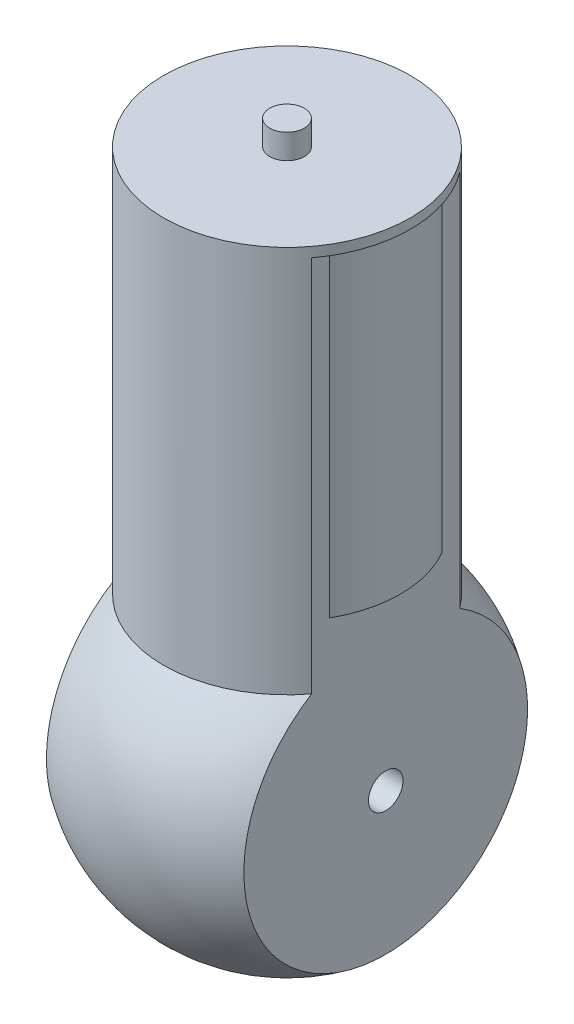
from build123d import *
from build123d.topology import SkipClean

# Parameters (mm, degrees)
CUT_EXTRUDE1_DEPTH      = 35
CUT_EXTRUDE1_DEPTH_BACK = 35
SKETCH2_OUTSIDE_W       = 96.248
SKETCH2_OUTSIDE_H       = 96.248
BOSS_EXTRUDE1_DEPTH     = 36
SKETCH4_R               = 3.5
CUT_EXTRUDE2_DEPTH      = 5
LPATTERN1_COUNT         = 2
LPATTERN1_PITCH         = 35
BOSS_EXTRUDE2_DEPTH     = 50
BOSS_EXTRUDE6_DEPTH     = 15
SKETCH10_R              = 25
BOSS_EXTRUDE7_DEPTH     = 2
SKETCH11_R              = 3.5
BOSS_EXTRUDE8_DEPTH     = 5


with BuildPart() as part:
    # Sketch1 → Revolve2 (revolve)
    with BuildSketch(Plane(origin=(0, 0, 0), x_dir=(1, 0, 0), z_dir=(0, 1, 0))):
        with BuildLine():
            Line((0, 35), (0, -35))
            ThreePointArc((0, -35), (35, 0), (0, 35))
        make_face()
    revolve(axis=Axis((0, 0, -35), (0, 0, 1)))

    # Sketch2 outside → Cut-Extrude1 (cut, two sides: drawn at the far end of the back side and taken through both)
    with SkipClean():  # the faces are left unmerged after this step: merging them gives an invalid solid
        with BuildSketch(Plane(origin=(0, 0, 0), x_dir=(1, 0, 0), z_dir=(0, 1, 0)).offset(-CUT_EXTRUDE1_DEPTH_BACK)):
            Rectangle(SKETCH2_OUTSIDE_W, SKETCH2_OUTSIDE_H)
            with BuildLine():
                Line((-20, -28.722813233), (-20, 28.722813233))
                ThreePointArc((-20, 28.722813233), (0, 35), (20, 28.722813233))
                Line((20, 28.722813233), (20, -28.722813233))
                ThreePointArc((20, -28.722813233), (0, -35), (-20, -28.722813233))
            make_face(mode=Mode.SUBTRACT)
        extrude(amount=CUT_EXTRUDE1_DEPTH + CUT_EXTRUDE1_DEPTH_BACK, mode=Mode.SUBTRACT)

    # Sketch3 → Boss-Extrude1 (add)
    with BuildSketch(Plane(origin=(0, 0, 0), x_dir=(1, 0, 0), z_dir=(0, 1, 0))):
        with BuildLine():
            Line((-20, 15), (-20, -15))
            ThreePointArc((-20, -15), (0, -25), (20, -15))
            Line((20, -15), (20, 15))
            ThreePointArc((20, 15), (0, 25), (-20, 15))
        make_face()
    extrude(amount=BOSS_EXTRUDE1_DEPTH)

    # Sketch4 → Cut-Extrude2 (cut)
    with BuildSketch(Plane.ZY.offset(20)):
        Circle(SKETCH4_R)
    cut_extrude2 = extrude(amount=-CUT_EXTRUDE2_DEPTH, mode=Mode.SUBTRACT)

    # LPattern1: Cut-Extrude2 ×2
    with Locations(*[(i * LPATTERN1_PITCH, 0, 0) for i in range(1, LPATTERN1_COUNT)]):
        add(cut_extrude2, mode=Mode.SUBTRACT)

    # Sketch5 → Boss-Extrude2 (add)
    with BuildSketch(Plane(origin=(0, 36, 0), x_dir=(1, 0, 0), z_dir=(0, 1, 0))):
        with BuildLine():
            Line((-20, 15), (-20, 11.357816692))
            ThreePointArc((-20, 11.357816692), (-23, 0), (-20, -11.357816692))
            Line((-20, -11.357816692), (-20, -15))
            ThreePointArc((-20, -15), (0, -25), (20, -15))
            Line((20, -15), (20, -11.357816692))
            ThreePointArc((20, -11.357816692), (23, 0), (20, 11.357816692))
            Line((20, 11.357816692), (20, 15))
            ThreePointArc((20, 15), (0, 25), (-20, 15))
        make_face()
    extrude(amount=BOSS_EXTRUDE2_DEPTH)

    # Sketch9 → Boss-Extrude6 (add)
    with BuildSketch(Plane(origin=(0, 86, 0), x_dir=(1, 0, 0), z_dir=(0, 1, 0))):
        with BuildLine():
            Line((20, 11.357816692), (20, 15))
            ThreePointArc((20, 15), (0, 25), (-20, 15))
            Line((-20, 15), (-20, 11.357816692))
            ThreePointArc((-20, 11.357816692), (-23, 0), (-20, -11.357816692))
            Line((-20, -11.357816692), (-20, -15))
            ThreePointArc((-20, -15), (0, -25), (20, -15))
            Line((20, -15), (20, -11.357816692))
            ThreePointArc((20, -11.357816692), (23, 0), (20, 11.357816692))
        make_face()
    extrude(amount=BOSS_EXTRUDE6_DEPTH)

    # Sketch10 → Boss-Extrude7 (add)
    with BuildSketch(Plane(origin=(0, 101, 0), x_dir=(1, 0, 0), z_dir=(0, 1, 0))):
        with Locations(Location((0, 0, 0), (0, 0, 36.869897646))):
            Circle(SKETCH10_R)
    extrude(amount=BOSS_EXTRUDE7_DEPTH)

    # Sketch11 → Boss-Extrude8 (add)
    with BuildSketch(Plane(origin=(0, 103, 0), x_dir=(1, 0, 0), z_dir=(0, 1, 0))):
        with Locations(Location((0, 0, 0), (0, 0, 270))):
            Circle(SKETCH11_R)
    extrude(amount=BOSS_EXTRUDE8_DEPTH)


solid = part.part
